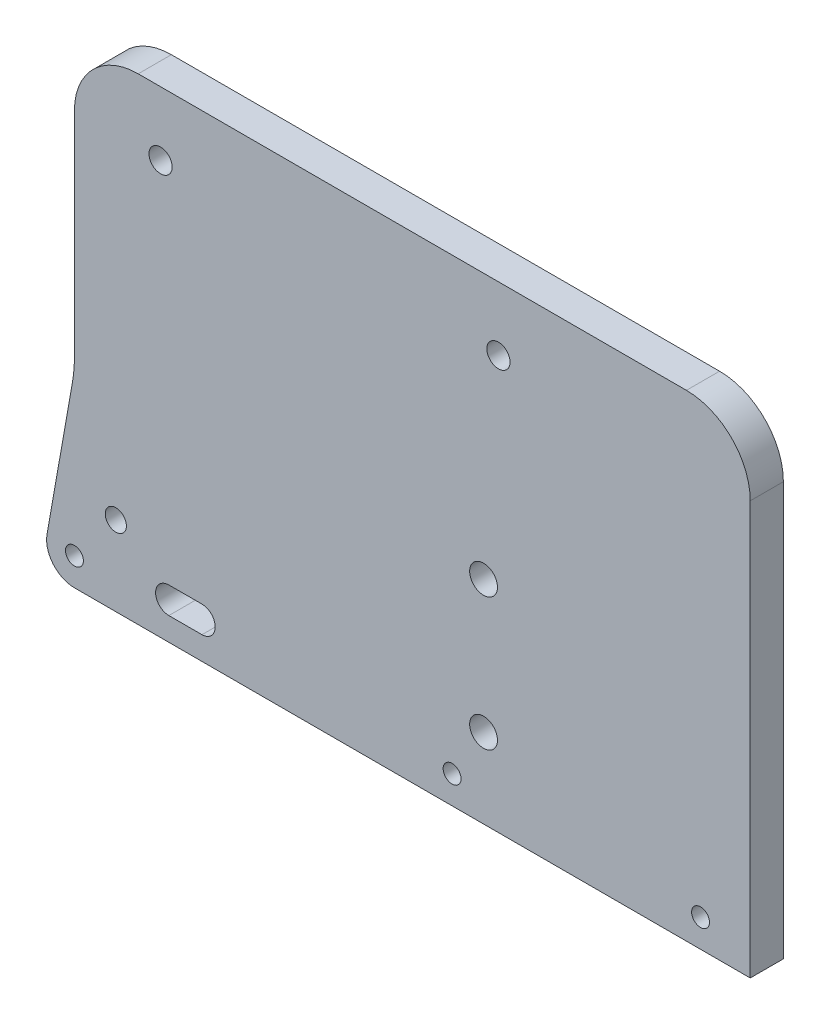
from build123d import *

# Parameters (mm, degrees)
SKETCH1_R           = 2.1
SKETCH1_R_2         = 1.75
SKETCH1_R_3         = 1.35
SKETCH1_R_4         = 1.6
BOSS_EXTRUDE1_DEPTH = 5


with BuildPart() as part:
    # Sketch1 → Boss-Extrude1 (new body)
    with BuildSketch(Plane.XY):
        with BuildLine():
            Line((-62.05384494, 14.663645746), (-65.886192563, -7.070677654))
            ThreePointArc((-65.886192563, -7.070677654), (-64.967386661, -10.499707961), (-61.75, -12))
            Line((-61.75, -12), (40.25, -12))
            Line((40.25, -12), (40.25, 50.37))
            ThreePointArc((40.25, 50.37), (37.429438303, 57.179438303), (30.62, 60))
            Line((30.62, 60), (-52.12, 60))
            ThreePointArc((-52.12, 60), (-58.929438303, 57.179438303), (-61.75, 50.37))
            Line((-61.75, 50.37), (-61.75, 18.1366093))
            ThreePointArc((-61.75, 18.1366093), (-61.826106038, 16.393494445), (-62.05384494, 14.663645746))
        make_face()
        Circle(SKETCH1_R, mode=Mode.SUBTRACT)
        with Locations((-48.75, 50.37)):
            Circle(SKETCH1_R_2, mode=Mode.SUBTRACT)
        with Locations((32.75, -7.8)):
            Circle(SKETCH1_R_3, mode=Mode.SUBTRACT)
        with Locations(Location((2.25, 50.37, 0), (0, 0, 180))):
            Circle(SKETCH1_R_2, mode=Mode.SUBTRACT)
        with Locations((-61.75, -7.8)):
            Circle(SKETCH1_R_3, mode=Mode.SUBTRACT)
        with Locations((-4.75, -7.8)):
            Circle(SKETCH1_R_3, mode=Mode.SUBTRACT)
        with Locations((0, 20)):
            Circle(SKETCH1_R, mode=Mode.SUBTRACT)
        with Locations((-55.5, 0)):
            Circle(SKETCH1_R_4, mode=Mode.SUBTRACT)
        with BuildLine():
            Line((-47.5, -4.5), (-42.5, -4.5))
            ThreePointArc((-42.5, -4.5), (-40.5, -6.5), (-42.5, -8.5))
            Line((-42.5, -8.5), (-47.5, -8.5))
            ThreePointArc((-47.5, -8.5), (-49.5, -6.5), (-47.5, -4.5))
        make_face(mode=Mode.SUBTRACT)
    extrude(amount=BOSS_EXTRUDE1_DEPTH)


solid = part.part
